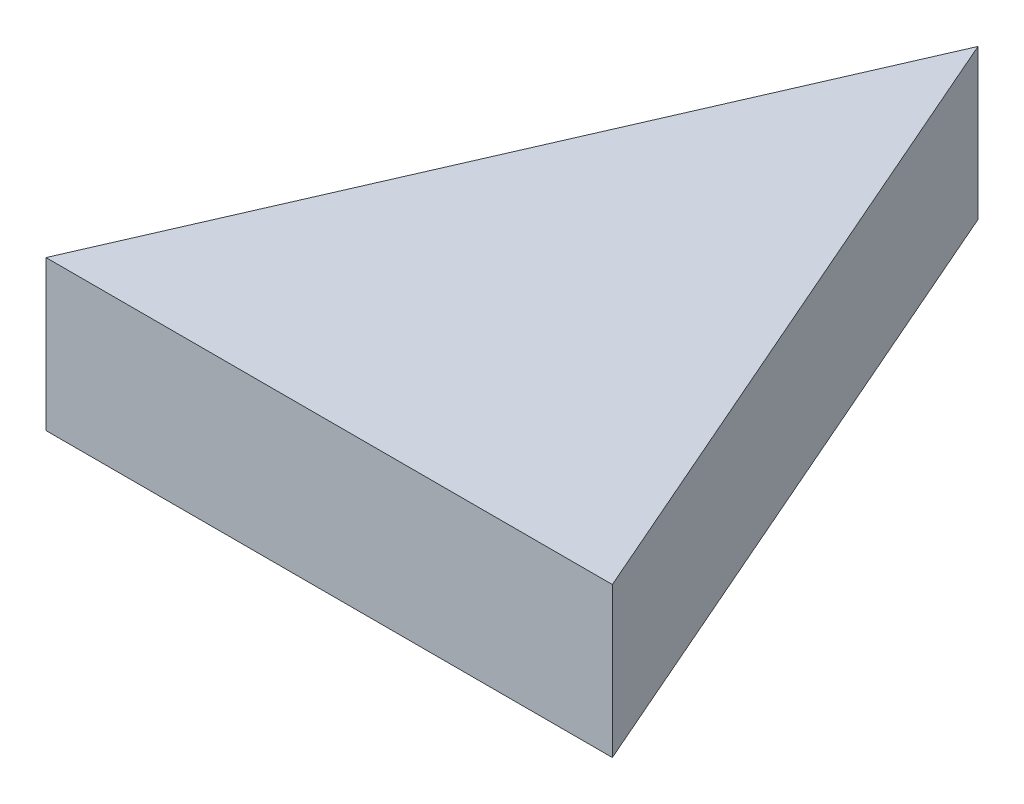
from build123d import *

# Parameters (mm, degrees)
BOSS_EXTRUDE1_DEPTH = 3.175


with BuildPart() as part:
    # Sketch1 → Boss-Extrude1 (new body)
    with BuildSketch(Plane(origin=(0, 0, 0), x_dir=(1, 0, 0), z_dir=(0, 1, 0))):
        Polygon((0, 0), (12, 0), (6, 13.747727085), align=None)
    extrude(amount=BOSS_EXTRUDE1_DEPTH)


solid = part.part
